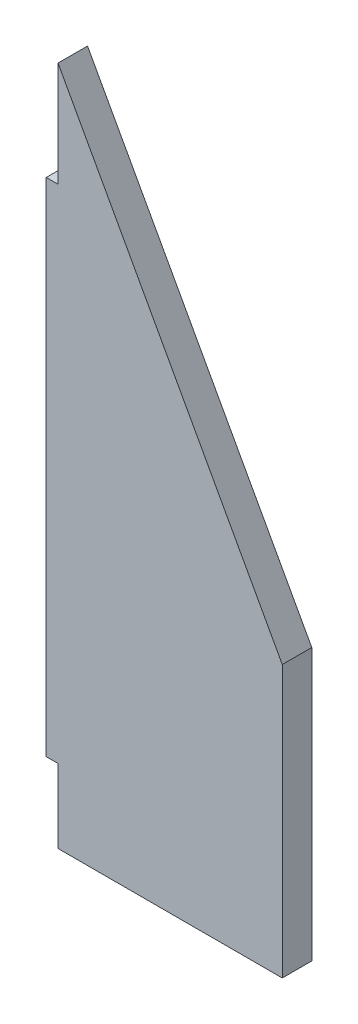
from build123d import *

# Parameters (mm, degrees)
BOSS_EXTRUDE1_DEPTH = 6.35


with BuildPart() as part:
    # Sketch1 → Boss-Extrude1 (new body)
    with BuildSketch(Plane.XY):
        Polygon((-2.328391652, 15.850315583), (0.211608348, 15.850315583), (0.211608348, 0), (48.471608348, 0), (48.471608348, 58.42), (0.211608348, 146.39148807), (0.211608348, 123.800315583), (-2.328391652, 123.800315583), align=None)
    extrude(amount=BOSS_EXTRUDE1_DEPTH)


solid = part.part
